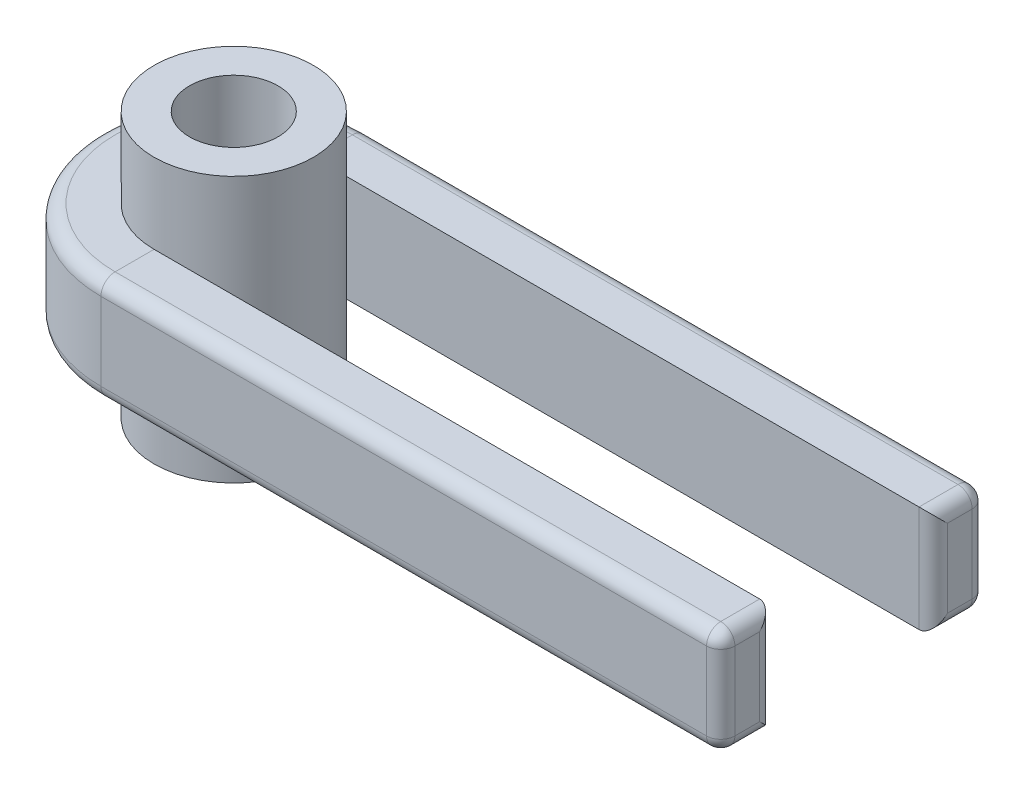
from build123d import *

# Parameters (mm, degrees)
SKETCH1_R           = 4.5
BOSS_EXTRUDE1_DEPTH = 15
SKETCH2_R           = 2.5
CUT_EXTRUDE1_DEPTH  = 17.294170737
SKETCH4_W           = 3
SKETCH4_H           = 6
FILLET1_R           = 0.8


with BuildPart() as part:
    # Sketch1 → Boss-Extrude1 (new body)
    with BuildSketch(Plane(origin=(0, 0, 0), x_dir=(1, 0, 0), z_dir=(0, 1, 0))):
        with Locations(Location((0, 0, 0), (0, 0, 270))):
            Circle(SKETCH1_R)
    extrude(amount=BOSS_EXTRUDE1_DEPTH)

    # Sketch2 → Cut-Extrude1 (cut, through all)
    with BuildSketch(Plane(origin=(0, 15, 0), x_dir=(1, 0, 0), z_dir=(0, 1, 0))):
        with Locations(Location((0, 0, 0), (0, 0, 270))):
            Circle(SKETCH2_R)
    extrude(amount=-CUT_EXTRUDE1_DEPTH, mode=Mode.SUBTRACT)

    # Sweep1: sweep along a path in Sketch3
    with BuildLine(Plane(origin=(0, 7.5, 0), x_dir=(1, 0, 0), z_dir=(0, 1, 0))) as sweep1_path:
        Line((35, 6), (0, 6))
        ThreePointArc((0, 6), (-6, 0), (0, -6))
        Line((0, -6), (35, -6))
    # Sketch4 → Sweep1 (sweep)
    with BuildSketch(Plane(origin=(35, 0, 0), x_dir=(0, 0, -1), z_dir=(1, 0, 0))):
        with Locations((6, 7.5)):
            Rectangle(SKETCH4_W, SKETCH4_H)
    sweep(path=sweep1_path.line)

    # Fillet1
    fillet1_edges = [part.edges().sort_by_distance(p)[0] for p in [
        (35, 7.5, -7.5),
        (35, 10.5, -6),
        (35, 7.5, -4.5),
        (35, 4.5, -6),
        (35, 7.5, 4.5),
        (17.5, 4.5, 7.5),
        (35, 4.5, 6),
        (17.5, 10.5, 7.5),
        (35, 7.5, 7.5),
        (35, 10.5, 6),
        (-7.5, 4.5, 0),
        (-7.5, 10.5, 0),
        (17.5, 4.5, -7.5),
        (17.5, 10.5, -7.5),
    ]]
    fillet(fillet1_edges, radius=FILLET1_R)


solid = part.part
